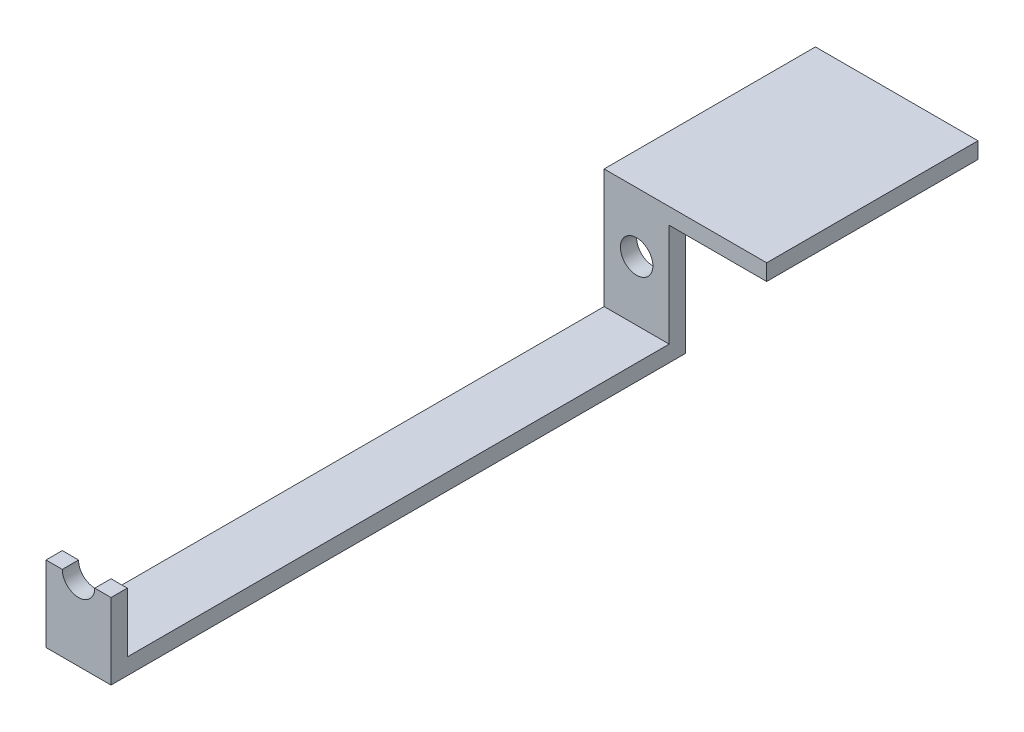
from build123d import *

# Parameters (mm, degrees)
EXTRUDE_1_DEPTH     = 12
CUT_EXTRUDE_1_REACH = 111.567
SKETCH_3_R          = 3
SKETCH_5_W          = 39
SKETCH_5_H          = 3
EXTRUDE_2_DEPTH     = 18


with BuildPart() as part:
    # 草图2 → 凸台-拉伸1 (new body)
    with BuildSketch(Plane(origin=(0, 0, 0), x_dir=(0, 0, -1), z_dir=(1, 0, 0))):
        Polygon((-53, 0), (53, 0), (53, 20), (53, 22), (89, 22), (89, 25), (50, 25), (50, 20), (50, 3), (-50, 3), (-50, 14), (-53, 14), align=None)
    extrude(amount=EXTRUDE_1_DEPTH)

    # 切除-拉伸1: up to this face of the body (flat: up to its plane)
    cut_extrude_1_end = Plane(part.part.faces().sort_by_distance((6, 7, 53))[0])
    # 草图3 → 切除-拉伸1 (cut, up to the picked face)
    with BuildSketch(Plane(origin=(0, 0, -53), x_dir=(-1, 0, 0), z_dir=(0, 0, -1)), mode=Mode.PRIVATE) as cut_extrude_1_sk1:
        with Locations((-6, 14)):
            Circle(SKETCH_3_R)
    cut_extrude_1_tool1 = split(extrude(cut_extrude_1_sk1.sketch, amount=-CUT_EXTRUDE_1_REACH, mode=Mode.PRIVATE), bisect_by=cut_extrude_1_end, keep=Keep.BOTH, mode=Mode.PRIVATE)
    add(cut_extrude_1_tool1.solids().sort_by(Axis((6, 14, -53), (0, 0, 1)))[0], mode=Mode.SUBTRACT)

    # 草图5 → 凸台-拉伸2 (add)
    with BuildSketch(Plane(origin=(12, 0, 0), x_dir=(0, 0, -1), z_dir=(1, 0, 0))):
        with Locations((69.5, 23.5)):
            Rectangle(SKETCH_5_W, SKETCH_5_H)
    extrude(amount=EXTRUDE_2_DEPTH)


solid = part.part
